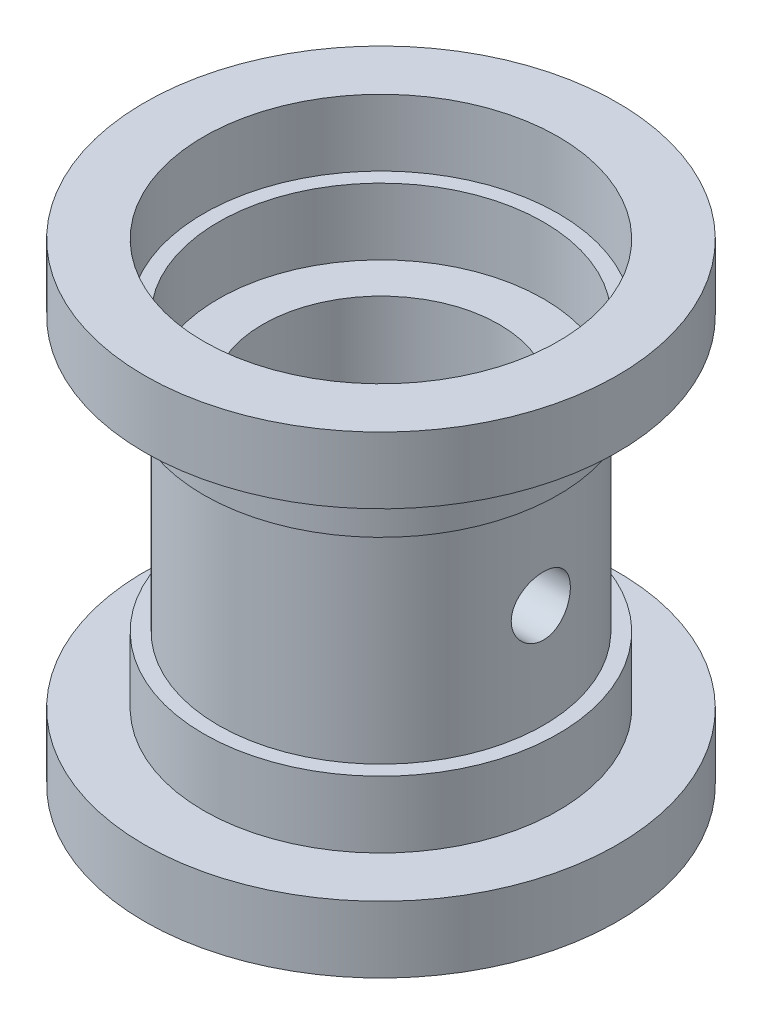
from build123d import *

# Parameters (mm, degrees)
SKETCH1_R           = 22
SKETCH1_R_2         = 16
BOSS_EXTRUDE1_DEPTH = 14
SKETCH1_5_R         = 24
SKETCH1_5_R_2       = 22
BOSS_EXTRUDE3_DEPTH = 23
SKETCH1_6_R         = 32
SKETCH1_6_R_2       = 24
BOSS_EXTRUDE4_DEPTH = 32
SKETCH1_7_R         = 24
SKETCH1_7_R_2       = 22
CUT_EXTRUDE1_DEPTH  = 14
SKETCH1_8_R         = 32
SKETCH1_8_R_2       = 24
CUT_EXTRUDE2_DEPTH  = 23
SKETCH2_R           = 4
CUT_EXTRUDE3_DEPTH  = 23


with BuildPart() as part:
    # Sketch1 → Boss-Extrude1 (new, symmetric)
    with BuildSketch(Plane(origin=(0, 0, 0), x_dir=(1, 0, 0), z_dir=(0, 1, 0))):
        Circle(SKETCH1_R)
        Circle(SKETCH1_R_2, mode=Mode.SUBTRACT)
    extrude(amount=BOSS_EXTRUDE1_DEPTH, both=True)

    # Sketch1<5> → Boss-Extrude3 (add, symmetric)
    with BuildSketch(Plane(origin=(0, 0, 0), x_dir=(1, 0, 0), z_dir=(0, 1, 0))):
        Circle(SKETCH1_5_R)
        Circle(SKETCH1_5_R_2, mode=Mode.SUBTRACT)
    extrude(amount=BOSS_EXTRUDE3_DEPTH, both=True)

    # Sketch1<6> → Boss-Extrude4 (add, symmetric)
    with BuildSketch(Plane(origin=(0, 0, 0), x_dir=(1, 0, 0), z_dir=(0, 1, 0))):
        Circle(SKETCH1_6_R)
        Circle(SKETCH1_6_R_2, mode=Mode.SUBTRACT)
    extrude(amount=BOSS_EXTRUDE4_DEPTH, both=True)

    # Sketch1<7> → Cut-Extrude1 (cut, symmetric)
    with BuildSketch(Plane(origin=(0, 0, 0), x_dir=(1, 0, 0), z_dir=(0, 1, 0))):
        Circle(SKETCH1_7_R)
        Circle(SKETCH1_7_R_2, mode=Mode.SUBTRACT)
    extrude(amount=CUT_EXTRUDE1_DEPTH, both=True, mode=Mode.SUBTRACT)


with BuildPart() as cut_extrude1_piece_1:
    # of the separate pieces the step leaves, piece 1, a body of its own (cut_extrude1_pieces)
    add(part.part.solids().sort_by_distance((32, -32, 0))[0])

    # Sketch1<8> → Cut-Extrude2 (cut, symmetric)
    with BuildSketch(Plane(origin=(0, 0, 0), x_dir=(1, 0, 0), z_dir=(0, 1, 0))):
        Circle(SKETCH1_8_R)
        Circle(SKETCH1_8_R_2, mode=Mode.SUBTRACT)
    extrude(amount=CUT_EXTRUDE2_DEPTH, both=True, mode=Mode.SUBTRACT)


with BuildPart() as cut_extrude1_piece_2:
    # of the separate pieces the step leaves, piece 2, a body of its own (cut_extrude1_pieces)
    add(part.part.solids().sort_by_distance((16, -14, 0))[0])

    # Sketch2 → Cut-Extrude3 (cut, symmetric)
    with BuildSketch(Plane(origin=(0, 0, 0), x_dir=(0, 0, -1), z_dir=(1, 0, 0))):
        Circle(SKETCH2_R)
    extrude(amount=CUT_EXTRUDE3_DEPTH, both=True, mode=Mode.SUBTRACT)


with BuildPart() as cut_extrude2_piece_1:
    # of the separate pieces the step leaves, piece 1, a body of its own (cut_extrude2_pieces)
    add(cut_extrude1_piece_1.part.solids().sort_by_distance((32, -32, 0))[0])


with BuildPart() as cut_extrude2_piece_2:
    # of the separate pieces the step leaves, piece 2, a body of its own (cut_extrude2_pieces)
    add(cut_extrude1_piece_1.part.solids().sort_by_distance((32, 23, 0))[0])


with BuildPart() as cut_extrude2_piece_3:
    # of the separate pieces the step leaves, piece 3, a body of its own (cut_extrude2_pieces)
    add(cut_extrude1_piece_1.part.solids().sort_by_distance((22, -23, 0))[0])


with BuildPart() as cut_extrude2_piece_4:
    # of the separate pieces the step leaves, piece 4, a body of its own (cut_extrude2_pieces)
    add(cut_extrude1_piece_1.part.solids().sort_by_distance((22, 23, 0))[0])


solid = Compound([cut_extrude1_piece_2.part, cut_extrude2_piece_1.part, cut_extrude2_piece_2.part, cut_extrude2_piece_3.part, cut_extrude2_piece_4.part])
